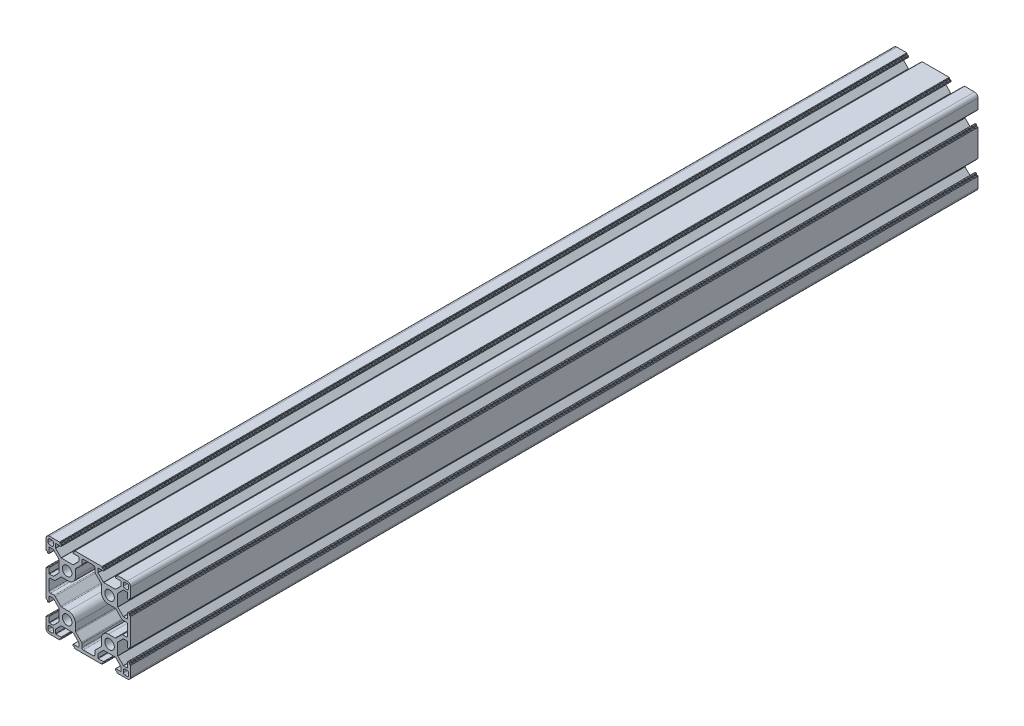
from build123d import *

# Parameters (mm, degrees)
MODEL_R             = 3.4
BOSS_EXTRUDE1_DEPTH = 600


with BuildPart() as part:
    # Model → Boss-Extrude1 (new body)
    with BuildSketch(Plane.XY):
        with BuildLine():
            Line((7.05, -27.8), (10.6, -27.8))
            ThreePointArc((10.6, -27.8), (10.812132034, -27.887867966), (10.9, -28.1))
            Line((10.9, -28.1), (10.9, -28.7))
            ThreePointArc((10.9, -28.7), (10.812132034, -28.912132034), (10.6, -29))
            Line((10.6, -29), (10.1, -29))
            ThreePointArc((10.1, -29), (9.887867966, -29.087867966), (9.8, -29.3))
            Line((9.8, -29.3), (9.8, -29.7))
            ThreePointArc((9.8, -29.7), (9.712132034, -29.912132034), (9.5, -30))
            Line((9.5, -30), (0, -30))
            Line((0, -30), (-9.5, -30))
            ThreePointArc((-9.5, -30), (-9.712132034, -29.912132034), (-9.8, -29.7))
            Line((-9.8, -29.7), (-9.8, -29.3))
            ThreePointArc((-9.8, -29.3), (-9.887867966, -29.087867966), (-10.1, -29))
            Line((-10.1, -29), (-10.6, -29))
            ThreePointArc((-10.6, -29), (-10.812132034, -28.912132034), (-10.9, -28.7))
            Line((-10.9, -28.7), (-10.9, -28.1))
            ThreePointArc((-10.9, -28.1), (-10.812132034, -27.887867966), (-10.6, -27.8))
            Line((-10.6, -27.8), (-7.05, -27.8))
            ThreePointArc((-7.05, -27.8), (-6.837867966, -27.712132034), (-6.75, -27.5))
            Line((-6.75, -27.5), (-6.75, -24.929898987))
            ThreePointArc((-6.75, -24.929898987), (-6.77283614, -24.815093958), (-6.837867966, -24.717766953))
            Line((-6.837867966, -24.717766953), (-10.667766953, -20.887867966))
            ThreePointArc((-10.667766953, -20.887867966), (-10.765093958, -20.82283614), (-10.879898987, -20.8))
            Line((-10.879898987, -20.8), (-15, -20.8))
            Line((-15, -20.8), (-19.120101013, -20.8))
            ThreePointArc((-19.120101013, -20.8), (-19.234906042, -20.82283614), (-19.332233047, -20.887867966))
            Line((-19.332233047, -20.887867966), (-23.162132034, -24.717766953))
            ThreePointArc((-23.162132034, -24.717766953), (-23.22716386, -24.815093958), (-23.25, -24.929898987))
            Line((-23.25, -24.929898987), (-23.25, -27.5))
            ThreePointArc((-23.25, -27.5), (-23.162132034, -27.712132034), (-22.95, -27.8))
            Line((-22.95, -27.8), (-19.4, -27.8))
            ThreePointArc((-19.4, -27.8), (-19.187867966, -27.887867966), (-19.1, -28.1))
            Line((-19.1, -28.1), (-19.1, -28.7))
            ThreePointArc((-19.1, -28.7), (-19.187867966, -28.912132034), (-19.4, -29))
            Line((-19.4, -29), (-19.9, -29))
            ThreePointArc((-19.9, -29), (-20.112132034, -29.087867966), (-20.2, -29.3))
            Line((-20.2, -29.3), (-20.2, -29.7))
            ThreePointArc((-20.2, -29.7), (-20.287867966, -29.912132034), (-20.5, -30))
            Line((-20.5, -30), (-27.5, -30))
            ThreePointArc((-27.5, -30), (-29.267766953, -29.267766953), (-30, -27.5))
            Line((-30, -27.5), (-30, -20.5))
            ThreePointArc((-30, -20.5), (-29.912132034, -20.287867965), (-29.7, -20.2))
            Line((-29.7, -20.2), (-29.3, -20.2))
            ThreePointArc((-29.3, -20.2), (-29.087867966, -20.112132034), (-29, -19.9))
            Line((-29, -19.9), (-29, -19.4))
            ThreePointArc((-29, -19.4), (-28.912132034, -19.187867966), (-28.7, -19.1))
            Line((-28.7, -19.1), (-28.1, -19.1))
            ThreePointArc((-28.1, -19.1), (-27.887867966, -19.187867966), (-27.8, -19.4))
            Line((-27.8, -19.4), (-27.8, -22.95))
            ThreePointArc((-27.8, -22.95), (-27.712132034, -23.162132034), (-27.5, -23.25))
            Line((-27.5, -23.25), (-24.929898987, -23.25))
            ThreePointArc((-24.929898987, -23.25), (-24.815093958, -23.22716386), (-24.717766953, -23.162132034))
            Line((-24.717766953, -23.162132034), (-20.887867966, -19.332233047))
            ThreePointArc((-20.887867966, -19.332233047), (-20.82283614, -19.234906042), (-20.8, -19.120101013))
            Line((-20.8, -19.120101013), (-20.8, -15))
            Line((-20.8, -15), (-20.8, -10.879898987))
            ThreePointArc((-20.8, -10.879898987), (-20.82283614, -10.765093958), (-20.887867966, -10.667766953))
            Line((-20.887867966, -10.667766953), (-24.717766953, -6.837867966))
            ThreePointArc((-24.717766953, -6.837867966), (-24.815093958, -6.77283614), (-24.929898987, -6.75))
            Line((-24.929898987, -6.75), (-27.5, -6.75))
            ThreePointArc((-27.5, -6.75), (-27.712132034, -6.837867966), (-27.8, -7.05))
            Line((-27.8, -7.05), (-27.8, -10.6))
            ThreePointArc((-27.8, -10.6), (-27.887867966, -10.812132034), (-28.1, -10.9))
            Line((-28.1, -10.9), (-28.7, -10.9))
            ThreePointArc((-28.7, -10.9), (-28.912132034, -10.812132034), (-29, -10.6))
            Line((-29, -10.6), (-29, -10.1))
            ThreePointArc((-29, -10.1), (-29.087867966, -9.887867966), (-29.3, -9.8))
            Line((-29.3, -9.8), (-29.7, -9.8))
            ThreePointArc((-29.7, -9.8), (-29.912132034, -9.712132034), (-30, -9.5))
            Line((-30, -9.5), (-30, 9.5))
            ThreePointArc((-30, 9.5), (-29.912132034, 9.712132034), (-29.7, 9.8))
            Line((-29.7, 9.8), (-29.3, 9.8))
            ThreePointArc((-29.3, 9.8), (-29.087867966, 9.887867966), (-29, 10.1))
            Line((-29, 10.1), (-29, 10.6))
            ThreePointArc((-29, 10.6), (-28.912132034, 10.812132034), (-28.7, 10.9))
            Line((-28.7, 10.9), (-28.1, 10.9))
            ThreePointArc((-28.1, 10.9), (-27.887867966, 10.812132034), (-27.8, 10.6))
            Line((-27.8, 10.6), (-27.8, 7.05))
            ThreePointArc((-27.8, 7.05), (-27.712132034, 6.837867966), (-27.5, 6.75))
            Line((-27.5, 6.75), (-24.929898987, 6.75))
            ThreePointArc((-24.929898987, 6.75), (-24.815093958, 6.77283614), (-24.717766953, 6.837867966))
            Line((-24.717766953, 6.837867966), (-20.887867966, 10.667766953))
            ThreePointArc((-20.887867966, 10.667766953), (-20.82283614, 10.765093958), (-20.8, 10.879898987))
            Line((-20.8, 10.879898987), (-20.8, 15))
            Line((-20.8, 15), (-20.8, 19.120101013))
            ThreePointArc((-20.8, 19.120101013), (-20.82283614, 19.234906042), (-20.887867966, 19.332233047))
            Line((-20.887867966, 19.332233047), (-24.717766953, 23.162132034))
            ThreePointArc((-24.717766953, 23.162132034), (-24.815093958, 23.22716386), (-24.929898987, 23.25))
            Line((-24.929898987, 23.25), (-27.5, 23.25))
            ThreePointArc((-27.5, 23.25), (-27.712132034, 23.162132034), (-27.8, 22.95))
            Line((-27.8, 22.95), (-27.8, 19.4))
            ThreePointArc((-27.8, 19.4), (-27.887867966, 19.187867966), (-28.1, 19.1))
            Line((-28.1, 19.1), (-28.7, 19.1))
            ThreePointArc((-28.7, 19.1), (-28.912132034, 19.187867966), (-29, 19.4))
            Line((-29, 19.4), (-29, 19.9))
            ThreePointArc((-29, 19.9), (-29.087867966, 20.112132034), (-29.3, 20.2))
            Line((-29.3, 20.2), (-29.7, 20.2))
            ThreePointArc((-29.7, 20.2), (-29.912132034, 20.287867966), (-30, 20.5))
            Line((-30, 20.5), (-30, 27.5))
            ThreePointArc((-30, 27.5), (-29.267766953, 29.267766953), (-27.5, 30))
            Line((-27.5, 30), (-20.5, 30))
            ThreePointArc((-20.5, 30), (-20.287867966, 29.912132034), (-20.2, 29.7))
            Line((-20.2, 29.7), (-20.2, 29.3))
            ThreePointArc((-20.2, 29.3), (-20.112132034, 29.087867966), (-19.9, 29))
            Line((-19.9, 29), (-19.4, 29))
            ThreePointArc((-19.4, 29), (-19.187867966, 28.912132034), (-19.1, 28.7))
            Line((-19.1, 28.7), (-19.1, 28.1))
            ThreePointArc((-19.1, 28.1), (-19.187867966, 27.887867966), (-19.4, 27.8))
            Line((-19.4, 27.8), (-22.95, 27.8))
            ThreePointArc((-22.95, 27.8), (-23.162132034, 27.712132034), (-23.25, 27.5))
            Line((-23.25, 27.5), (-23.25, 24.929898987))
            ThreePointArc((-23.25, 24.929898987), (-23.22716386, 24.815093958), (-23.162132034, 24.717766953))
            Line((-23.162132034, 24.717766953), (-19.332233047, 20.887867966))
            ThreePointArc((-19.332233047, 20.887867966), (-19.234906042, 20.82283614), (-19.120101013, 20.8))
            Line((-19.120101013, 20.8), (-15, 20.8))
            Line((-15, 20.8), (-10.879898987, 20.8))
            ThreePointArc((-10.879898987, 20.8), (-10.765093958, 20.82283614), (-10.667766953, 20.887867966))
            Line((-10.667766953, 20.887867966), (-6.837867966, 24.717766953))
            ThreePointArc((-6.837867966, 24.717766953), (-6.77283614, 24.815093958), (-6.75, 24.929898987))
            Line((-6.75, 24.929898987), (-6.75, 27.5))
            ThreePointArc((-6.75, 27.5), (-6.837867966, 27.712132034), (-7.05, 27.8))
            Line((-7.05, 27.8), (-10.6, 27.8))
            ThreePointArc((-10.6, 27.8), (-10.812132034, 27.887867966), (-10.9, 28.1))
            Line((-10.9, 28.1), (-10.9, 28.7))
            ThreePointArc((-10.9, 28.7), (-10.812132034, 28.912132034), (-10.6, 29))
            Line((-10.6, 29), (-10.1, 29))
            ThreePointArc((-10.1, 29), (-9.887867966, 29.087867966), (-9.8, 29.3))
            Line((-9.8, 29.3), (-9.8, 29.7))
            ThreePointArc((-9.8, 29.7), (-9.712132034, 29.912132034), (-9.5, 30))
            Line((-9.5, 30), (0, 30))
            Line((0, 30), (9.5, 30))
            ThreePointArc((9.5, 30), (9.712132034, 29.912132034), (9.8, 29.7))
            Line((9.8, 29.7), (9.8, 29.3))
            ThreePointArc((9.8, 29.3), (9.887867966, 29.087867966), (10.1, 29))
            Line((10.1, 29), (10.6, 29))
            ThreePointArc((10.6, 29), (10.812132034, 28.912132034), (10.9, 28.7))
            Line((10.9, 28.7), (10.9, 28.1))
            ThreePointArc((10.9, 28.1), (10.812132034, 27.887867966), (10.6, 27.8))
            Line((10.6, 27.8), (7.05, 27.8))
            ThreePointArc((7.05, 27.8), (6.837867966, 27.712132034), (6.75, 27.5))
            Line((6.75, 27.5), (6.75, 24.929898987))
            ThreePointArc((6.75, 24.929898987), (6.77283614, 24.815093958), (6.837867966, 24.717766953))
            Line((6.837867966, 24.717766953), (10.667766953, 20.887867966))
            ThreePointArc((10.667766953, 20.887867966), (10.765093958, 20.82283614), (10.879898987, 20.8))
            Line((10.879898987, 20.8), (15, 20.8))
            Line((15, 20.8), (19.120101013, 20.8))
            ThreePointArc((19.120101013, 20.8), (19.234906042, 20.82283614), (19.332233047, 20.887867966))
            Line((19.332233047, 20.887867966), (23.162132034, 24.717766953))
            ThreePointArc((23.162132034, 24.717766953), (23.22716386, 24.815093958), (23.25, 24.929898987))
            Line((23.25, 24.929898987), (23.25, 27.5))
            ThreePointArc((23.25, 27.5), (23.162132034, 27.712132034), (22.95, 27.8))
            Line((22.95, 27.8), (19.4, 27.8))
            ThreePointArc((19.4, 27.8), (19.187867966, 27.887867966), (19.1, 28.1))
            Line((19.1, 28.1), (19.1, 28.7))
            ThreePointArc((19.1, 28.7), (19.187867966, 28.912132034), (19.4, 29))
            Line((19.4, 29), (19.9, 29))
            ThreePointArc((19.9, 29), (20.112132034, 29.087867966), (20.2, 29.3))
            Line((20.2, 29.3), (20.2, 29.7))
            ThreePointArc((20.2, 29.7), (20.287867966, 29.912132034), (20.5, 30))
            Line((20.5, 30), (27.5, 30))
            ThreePointArc((27.5, 30), (29.267766953, 29.267766953), (30, 27.5))
            Line((30, 27.5), (30, 20.5))
            ThreePointArc((30, 20.5), (29.912132034, 20.287867966), (29.7, 20.2))
            Line((29.7, 20.2), (29.3, 20.2))
            ThreePointArc((29.3, 20.2), (29.087867966, 20.112132034), (29, 19.9))
            Line((29, 19.9), (29, 19.4))
            ThreePointArc((29, 19.4), (28.912132034, 19.187867966), (28.7, 19.1))
            Line((28.7, 19.1), (28.1, 19.1))
            ThreePointArc((28.1, 19.1), (27.887867966, 19.187867966), (27.8, 19.4))
            Line((27.8, 19.4), (27.8, 22.95))
            ThreePointArc((27.8, 22.95), (27.712132034, 23.162132034), (27.5, 23.25))
            Line((27.5, 23.25), (24.929898987, 23.25))
            ThreePointArc((24.929898987, 23.25), (24.815093958, 23.22716386), (24.717766953, 23.162132034))
            Line((24.717766953, 23.162132034), (20.887867966, 19.332233047))
            ThreePointArc((20.887867966, 19.332233047), (20.82283614, 19.234906042), (20.8, 19.120101013))
            Line((20.8, 19.120101013), (20.8, 15))
            Line((20.8, 15), (20.8, 10.879898987))
            ThreePointArc((20.8, 10.879898987), (20.82283614, 10.765093958), (20.887867966, 10.667766953))
            Line((20.887867966, 10.667766953), (24.717766953, 6.837867966))
            ThreePointArc((24.717766953, 6.837867966), (24.815093958, 6.77283614), (24.929898987, 6.75))
            Line((24.929898987, 6.75), (27.5, 6.75))
            ThreePointArc((27.5, 6.75), (27.712132034, 6.837867966), (27.8, 7.05))
            Line((27.8, 7.05), (27.8, 10.6))
            ThreePointArc((27.8, 10.6), (27.887867966, 10.812132034), (28.1, 10.9))
            Line((28.1, 10.9), (28.7, 10.9))
            ThreePointArc((28.7, 10.9), (28.912132034, 10.812132034), (29, 10.6))
            Line((29, 10.6), (29, 10.1))
            ThreePointArc((29, 10.1), (29.087867966, 9.887867966), (29.3, 9.8))
            Line((29.3, 9.8), (29.7, 9.8))
            ThreePointArc((29.7, 9.8), (29.912132034, 9.712132034), (30, 9.5))
            Line((30, 9.5), (30, -9.5))
            ThreePointArc((30, -9.5), (29.912132034, -9.712132034), (29.7, -9.8))
            Line((29.7, -9.8), (29.3, -9.8))
            ThreePointArc((29.3, -9.8), (29.087867966, -9.887867966), (29, -10.1))
            Line((29, -10.1), (29, -10.6))
            ThreePointArc((29, -10.6), (28.912132034, -10.812132034), (28.7, -10.9))
            Line((28.7, -10.9), (28.1, -10.9))
            ThreePointArc((28.1, -10.9), (27.887867966, -10.812132034), (27.8, -10.6))
            Line((27.8, -10.6), (27.8, -7.05))
            ThreePointArc((27.8, -7.05), (27.712132034, -6.837867966), (27.5, -6.75))
            Line((27.5, -6.75), (24.929898987, -6.75))
            ThreePointArc((24.929898987, -6.75), (24.815093958, -6.77283614), (24.717766953, -6.837867966))
            Line((24.717766953, -6.837867966), (20.887867966, -10.667766953))
            ThreePointArc((20.887867966, -10.667766953), (20.82283614, -10.765093958), (20.8, -10.879898987))
            Line((20.8, -10.879898987), (20.8, -15))
            Line((20.8, -15), (20.8, -19.120101013))
            ThreePointArc((20.8, -19.120101013), (20.82283614, -19.234906042), (20.887867966, -19.332233047))
            Line((20.887867966, -19.332233047), (24.717766953, -23.162132034))
            ThreePointArc((24.717766953, -23.162132034), (24.815093958, -23.22716386), (24.929898987, -23.25))
            Line((24.929898987, -23.25), (27.5, -23.25))
            ThreePointArc((27.5, -23.25), (27.712132034, -23.162132034), (27.8, -22.95))
            Line((27.8, -22.95), (27.8, -19.4))
            ThreePointArc((27.8, -19.4), (27.887867966, -19.187867966), (28.1, -19.1))
            Line((28.1, -19.1), (28.7, -19.1))
            ThreePointArc((28.7, -19.1), (28.912132034, -19.187867966), (29, -19.4))
            Line((29, -19.4), (29, -19.9))
            ThreePointArc((29, -19.9), (29.087867966, -20.112132034), (29.3, -20.2))
            Line((29.3, -20.2), (29.7, -20.2))
            ThreePointArc((29.7, -20.2), (29.912132034, -20.287867965), (30, -20.5))
            Line((30, -20.5), (30, -27.5))
            ThreePointArc((30, -27.5), (29.267766953, -29.267766953), (27.5, -30))
            Line((27.5, -30), (20.5, -30))
            ThreePointArc((20.5, -30), (20.287867966, -29.912132034), (20.2, -29.7))
            Line((20.2, -29.7), (20.2, -29.3))
            ThreePointArc((20.2, -29.3), (20.112132034, -29.087867966), (19.9, -29))
            Line((19.9, -29), (19.4, -29))
            ThreePointArc((19.4, -29), (19.187867966, -28.912132034), (19.1, -28.7))
            Line((19.1, -28.7), (19.1, -28.1))
            ThreePointArc((19.1, -28.1), (19.187867966, -27.887867966), (19.4, -27.8))
            Line((19.4, -27.8), (22.95, -27.8))
            ThreePointArc((22.95, -27.8), (23.162132034, -27.712132034), (23.25, -27.5))
            Line((23.25, -27.5), (23.25, -24.929898987))
            ThreePointArc((23.25, -24.929898987), (23.22716386, -24.815093958), (23.162132034, -24.717766953))
            Line((23.162132034, -24.717766953), (19.332233047, -20.887867966))
            ThreePointArc((19.332233047, -20.887867966), (19.234906042, -20.82283614), (19.120101013, -20.8))
            Line((19.120101013, -20.8), (15, -20.8))
            Line((15, -20.8), (10.879898987, -20.8))
            ThreePointArc((10.879898987, -20.8), (10.765093958, -20.82283614), (10.667766953, -20.887867966))
            Line((10.667766953, -20.887867966), (6.837867966, -24.717766953))
            ThreePointArc((6.837867966, -24.717766953), (6.77283614, -24.815093958), (6.75, -24.929898987))
            Line((6.75, -24.929898987), (6.75, -27.5))
            ThreePointArc((6.75, -27.5), (6.837867966, -27.712132034), (7.05, -27.8))
        make_face()
        with Locations((15, 15)):
            Circle(MODEL_R, mode=Mode.SUBTRACT)
        with Locations((15, -15)):
            Circle(MODEL_R, mode=Mode.SUBTRACT)
        with Locations((-15, -15)):
            Circle(MODEL_R, mode=Mode.SUBTRACT)
        with Locations((-15, 15)):
            Circle(MODEL_R, mode=Mode.SUBTRACT)
        with BuildLine():
            Line((24.75, -25.75), (24.75, -27.5))
            ThreePointArc((24.75, -27.5), (25.042893219, -28.207106781), (25.75, -28.5))
            Line((25.75, -28.5), (27.5, -28.5))
            ThreePointArc((27.5, -28.5), (28.207106781, -28.207106781), (28.5, -27.5))
            Line((28.5, -27.5), (28.5, -25.75))
            ThreePointArc((28.5, -25.75), (28.207106781, -25.042893219), (27.5, -24.75))
            Line((27.5, -24.75), (25.75, -24.75))
            ThreePointArc((25.75, -24.75), (25.042893219, -25.042893219), (24.75, -25.75))
        make_face(mode=Mode.SUBTRACT)
        with BuildLine():
            Line((-27.5, -24.75), (-25.75, -24.75))
            ThreePointArc((-25.75, -24.75), (-25.042893219, -25.042893219), (-24.75, -25.75))
            Line((-24.75, -25.75), (-24.75, -27.5))
            ThreePointArc((-24.75, -27.5), (-25.042893219, -28.207106781), (-25.75, -28.5))
            Line((-25.75, -28.5), (-27.5, -28.5))
            ThreePointArc((-27.5, -28.5), (-28.207106781, -28.207106781), (-28.5, -27.5))
            Line((-28.5, -27.5), (-28.5, -25.75))
            ThreePointArc((-28.5, -25.75), (-28.207106781, -25.042893219), (-27.5, -24.75))
        make_face(mode=Mode.SUBTRACT)
        with BuildLine():
            Line((9.2, -14.2), (9.2, -15))
            Line((9.2, -15), (9.2, -18.830151519))
            ThreePointArc((9.2, -18.830151519), (9.123879533, -19.212834951), (8.907106781, -19.5372583))
            Line((8.907106781, -19.5372583), (4.842893219, -23.601471863))
            ThreePointArc((4.842893219, -23.601471863), (4.626120467, -23.925895211), (4.55, -24.308578644))
            Line((4.55, -24.308578644), (4.55, -26.8))
            ThreePointArc((4.55, -26.8), (4.257106781, -27.507106781), (3.55, -27.8))
            Line((3.55, -27.8), (0, -27.8))
            Line((0, -27.8), (-3.55, -27.8))
            ThreePointArc((-3.55, -27.8), (-4.257106781, -27.507106781), (-4.55, -26.8))
            Line((-4.55, -26.8), (-4.55, -24.308578644))
            ThreePointArc((-4.55, -24.308578644), (-4.626120468, -23.925895211), (-4.842893219, -23.601471863))
            Line((-4.842893219, -23.601471863), (-8.907106781, -19.5372583))
            ThreePointArc((-8.907106781, -19.5372583), (-9.123879533, -19.212834951), (-9.2, -18.830151519))
            Line((-9.2, -18.830151519), (-9.2, -15))
            Line((-9.2, -15), (-9.2, -14.2))
            ThreePointArc((-9.2, -14.2), (-10.664466094, -10.664466094), (-14.2, -9.2))
            Line((-14.2, -9.2), (-15, -9.2))
            Line((-15, -9.2), (-18.830151519, -9.2))
            ThreePointArc((-18.830151519, -9.2), (-19.212834951, -9.123879532), (-19.5372583, -8.907106781))
            Line((-19.5372583, -8.907106781), (-23.601471863, -4.842893219))
            ThreePointArc((-23.601471863, -4.842893219), (-23.925895211, -4.626120467), (-24.308578644, -4.55))
            Line((-24.308578644, -4.55), (-26.8, -4.55))
            ThreePointArc((-26.8, -4.55), (-27.507106781, -4.257106781), (-27.8, -3.55))
            Line((-27.8, -3.55), (-27.8, 0))
            Line((-27.8, 0), (-27.8, 3.55))
            ThreePointArc((-27.8, 3.55), (-27.507106781, 4.257106781), (-26.8, 4.55))
            Line((-26.8, 4.55), (-24.308578644, 4.55))
            ThreePointArc((-24.308578644, 4.55), (-23.925895211, 4.626120467), (-23.601471863, 4.842893219))
            Line((-23.601471863, 4.842893219), (-19.5372583, 8.907106781))
            ThreePointArc((-19.5372583, 8.907106781), (-19.212834951, 9.123879532), (-18.830151519, 9.2))
            Line((-18.830151519, 9.2), (-15, 9.2))
            Line((-15, 9.2), (-14.2, 9.2))
            ThreePointArc((-14.2, 9.2), (-10.664466094, 10.664466094), (-9.2, 14.2))
            Line((-9.2, 14.2), (-9.2, 15))
            Line((-9.2, 15), (-9.2, 18.830151519))
            ThreePointArc((-9.2, 18.830151519), (-9.123879533, 19.212834951), (-8.907106781, 19.5372583))
            Line((-8.907106781, 19.5372583), (-4.842893219, 23.601471863))
            ThreePointArc((-4.842893219, 23.601471863), (-4.626120468, 23.925895211), (-4.55, 24.308578644))
            Line((-4.55, 24.308578644), (-4.55, 26.8))
            ThreePointArc((-4.55, 26.8), (-4.257106781, 27.507106781), (-3.55, 27.8))
            Line((-3.55, 27.8), (0, 27.8))
            Line((0, 27.8), (3.55, 27.8))
            ThreePointArc((3.55, 27.8), (4.257106781, 27.507106781), (4.55, 26.8))
            Line((4.55, 26.8), (4.55, 24.308578644))
            ThreePointArc((4.55, 24.308578644), (4.626120467, 23.925895211), (4.842893219, 23.601471863))
            Line((4.842893219, 23.601471863), (8.907106781, 19.5372583))
            ThreePointArc((8.907106781, 19.5372583), (9.123879533, 19.212834951), (9.2, 18.830151519))
            Line((9.2, 18.830151519), (9.2, 15))
            Line((9.2, 15), (9.2, 14.2))
            ThreePointArc((9.2, 14.2), (10.664466094, 10.664466094), (14.2, 9.2))
            Line((14.2, 9.2), (15, 9.2))
            Line((15, 9.2), (18.830151519, 9.2))
            ThreePointArc((18.830151519, 9.2), (19.212834951, 9.123879533), (19.5372583, 8.907106781))
            Line((19.5372583, 8.907106781), (23.601471863, 4.842893219))
            ThreePointArc((23.601471863, 4.842893219), (23.925895211, 4.626120467), (24.308578644, 4.55))
            Line((24.308578644, 4.55), (26.8, 4.55))
            ThreePointArc((26.8, 4.55), (27.507106781, 4.257106781), (27.8, 3.55))
            Line((27.8, 3.55), (27.8, 0))
            Line((27.8, 0), (27.8, -3.55))
            ThreePointArc((27.8, -3.55), (27.507106781, -4.257106781), (26.8, -4.55))
            Line((26.8, -4.55), (24.308578644, -4.55))
            ThreePointArc((24.308578644, -4.55), (23.925895211, -4.626120467), (23.601471863, -4.842893219))
            Line((23.601471863, -4.842893219), (19.5372583, -8.907106781))
            ThreePointArc((19.5372583, -8.907106781), (19.212834951, -9.123879533), (18.830151519, -9.2))
            Line((18.830151519, -9.2), (15, -9.2))
            Line((15, -9.2), (14.2, -9.2))
            ThreePointArc((14.2, -9.2), (12.286582838, -9.580602337), (10.664466094, -10.664466094))
            ThreePointArc((10.664466094, -10.664466094), (9.580602337, -12.286582838), (9.2, -14.2))
        make_face(mode=Mode.SUBTRACT)
        with BuildLine():
            Line((-27.5, 24.75), (-25.75, 24.75))
            ThreePointArc((-25.75, 24.75), (-25.042893219, 25.042893219), (-24.75, 25.75))
            Line((-24.75, 25.75), (-24.75, 27.5))
            ThreePointArc((-24.75, 27.5), (-25.042893219, 28.207106781), (-25.75, 28.5))
            Line((-25.75, 28.5), (-27.5, 28.5))
            ThreePointArc((-27.5, 28.5), (-28.207106781, 28.207106781), (-28.5, 27.5))
            Line((-28.5, 27.5), (-28.5, 25.75))
            ThreePointArc((-28.5, 25.75), (-28.207106781, 25.042893219), (-27.5, 24.75))
        make_face(mode=Mode.SUBTRACT)
        with BuildLine():
            Line((24.75, 25.75), (24.75, 27.5))
            ThreePointArc((24.75, 27.5), (25.042893219, 28.207106781), (25.75, 28.5))
            Line((25.75, 28.5), (27.5, 28.5))
            ThreePointArc((27.5, 28.5), (28.207106781, 28.207106781), (28.5, 27.5))
            Line((28.5, 27.5), (28.5, 25.75))
            ThreePointArc((28.5, 25.75), (28.207106781, 25.042893219), (27.5, 24.75))
            Line((27.5, 24.75), (25.75, 24.75))
            ThreePointArc((25.75, 24.75), (25.042893219, 25.042893219), (24.75, 25.75))
        make_face(mode=Mode.SUBTRACT)
    extrude(amount=BOSS_EXTRUDE1_DEPTH)


solid = part.part
